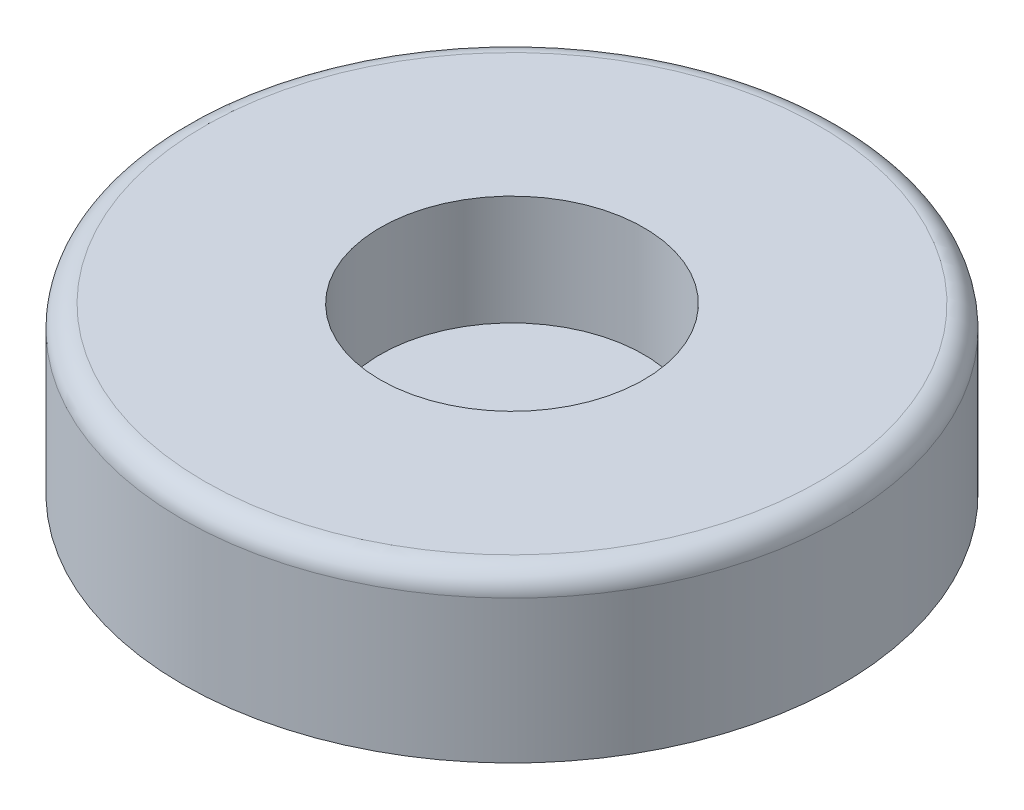
from build123d import *

# Parameters (mm, degrees)
SKETCH1_R           = 30
BOSS_EXTRUDE1_DEPTH = 15
SKETCH2_R           = 12
CUT_EXTRUDE1_DEPTH  = 10
FILLET1_R           = 2


with BuildPart() as part:
    # Sketch1 → Boss-Extrude1 (new body)
    with BuildSketch(Plane(origin=(0, 0, 0), x_dir=(1, 0, 0), z_dir=(0, 1, 0))):
        with Locations(Location((0, 0, 0), (0, 0, 270))):
            Circle(SKETCH1_R)
    extrude(amount=BOSS_EXTRUDE1_DEPTH)

    # Sketch2 → Cut-Extrude1 (cut)
    with BuildSketch(Plane(origin=(0, 15, 0), x_dir=(1, 0, 0), z_dir=(0, 1, 0))):
        with Locations(Location((0, 0, 0), (0, 0, 270))):
            Circle(SKETCH2_R)
    extrude(amount=-CUT_EXTRUDE1_DEPTH, mode=Mode.SUBTRACT)

    # Fillet1
    fillet1_edges = [part.edges().sort_by_distance(p)[0] for p in [
        (0, 15, -30),
    ]]
    fillet(fillet1_edges, radius=FILLET1_R)


solid = part.part
